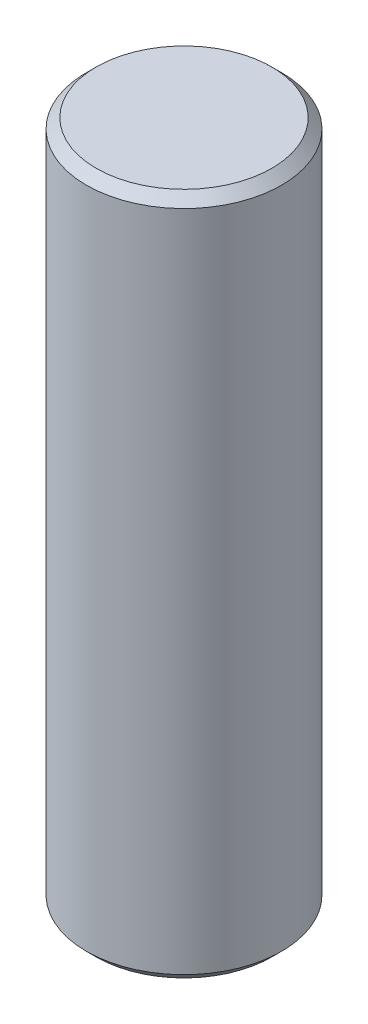
from build123d import *

# Parameters (mm, degrees)
BASES_R          = 2
BASE_DEPTH       = 7
BASECHAMFER_SIZE = 0.2


with BuildPart() as part:
    # BaseS → Base (new, symmetric)
    with BuildSketch(Plane(origin=(0, 0, 0), x_dir=(1, 0, 0), z_dir=(0, 1, 0))):
        Circle(BASES_R)
    extrude(amount=BASE_DEPTH, both=True)

    # BaseChamfer
    basechamfer_edges = [part.edges().sort_by_distance(p)[0] for p in [
        (-2, -7, 0),
        (-2, 7, 0),
    ]]
    chamfer(basechamfer_edges, length=BASECHAMFER_SIZE)


solid = part.part
